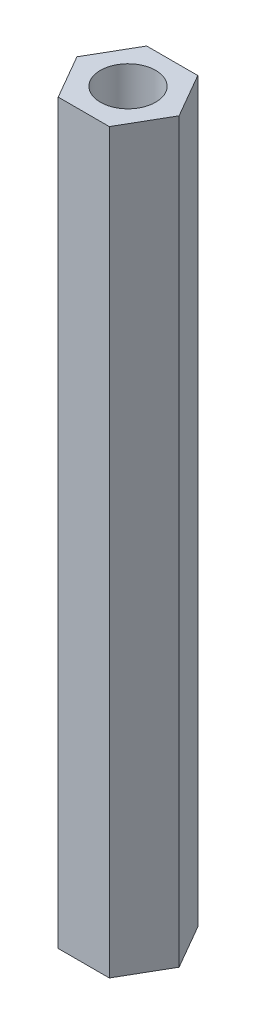
from build123d import *

# Parameters (mm, degrees)
SKETCH1_R           = 1.5
BOSS_EXTRUDE1_DEPTH = 40


with BuildPart() as part:
    # Sketch1 → Boss-Extrude1 (new body)
    with BuildSketch(Plane(origin=(0, 0, 0), x_dir=(1, 0, 0), z_dir=(0, 1, 0))):
        Polygon((-1.385640646, 2.4), (-2.771281292, 0), (-1.385640646, -2.4), (1.385640646, -2.4), (2.771281292, 0), (1.385640646, 2.4), align=None)
        with Locations(Location((0, 0, 0), (0, 0, 270))):
            Circle(SKETCH1_R, mode=Mode.SUBTRACT)
    extrude(amount=BOSS_EXTRUDE1_DEPTH)


solid = part.part
